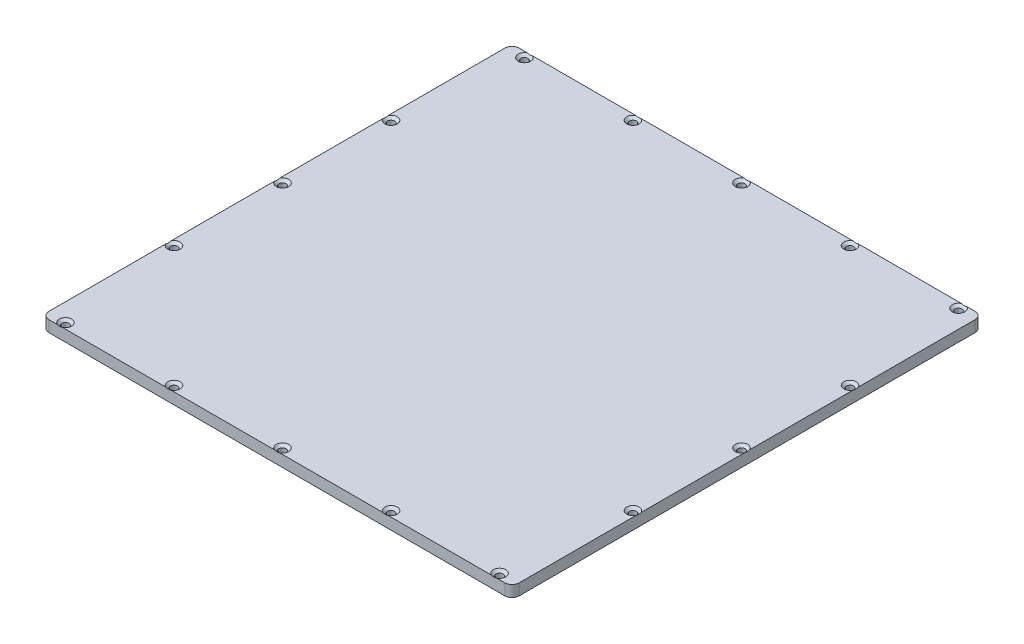
from build123d import *

# Parameters (mm, degrees)
SKETCH1_W                                         = 165.1
SKETCH1_H                                         = 165.1
BOSS_EXTRUDE1_DEPTH                               = 3.9624
CSK_FOR_2_FLAT_HEAD_MACHINE_SCREW_100_D           = 2.4384
CSK_FOR_2_FLAT_HEAD_MACHINE_SCREW_100_CSINK_D     = 4.3688
CSK_FOR_2_FLAT_HEAD_MACHINE_SCREW_100_CSINK_ANGLE = 100
FILLET2_R                                         = 2.54


with BuildPart() as part:
    # Sketch1 → Boss-Extrude1 (new body)
    with BuildSketch(Plane(origin=(0, 0, 0), x_dir=(1, 0, 0), z_dir=(0, 1, 0))):
        Rectangle(SKETCH1_W, SKETCH1_H)
    extrude(amount=-BOSS_EXTRUDE1_DEPTH)

    # CSK for #2 Flat Head Machine Screw (100)1 (through all)
    with Locations(Plane(origin=(0, 0, 0), x_dir=(1, 0, 0), z_dir=(0, 1, 0))):
        with Locations((-76.2, 80.5688), (-80.5688, 38.1), (-80.5688, 0), (-80.5688, -38.1), (-76.2, -80.5688), (-38.1, -80.5688), (0, -80.5688), (38.1, -80.5688), (80.5688, -38.1), (80.5688, 0), (80.5688, 38.1), (76.2, 80.5688), (38.1, 80.5688), (0, 80.5688), (-38.1, 80.5688), (76.2, -80.5688)):
            CounterSinkHole(CSK_FOR_2_FLAT_HEAD_MACHINE_SCREW_100_D / 2, CSK_FOR_2_FLAT_HEAD_MACHINE_SCREW_100_CSINK_D / 2, counter_sink_angle=CSK_FOR_2_FLAT_HEAD_MACHINE_SCREW_100_CSINK_ANGLE)

    # Fillet2
    fillet2_edges = [part.edges().sort_by_distance(p)[0] for p in [
        (82.55, -1.9812, 82.55),
        (-82.55, -1.9812, 82.55),
        (-82.55, -1.9812, -82.55),
        (82.55, -1.9812, -82.55),
    ]]
    fillet(fillet2_edges, radius=FILLET2_R)


solid = part.part
